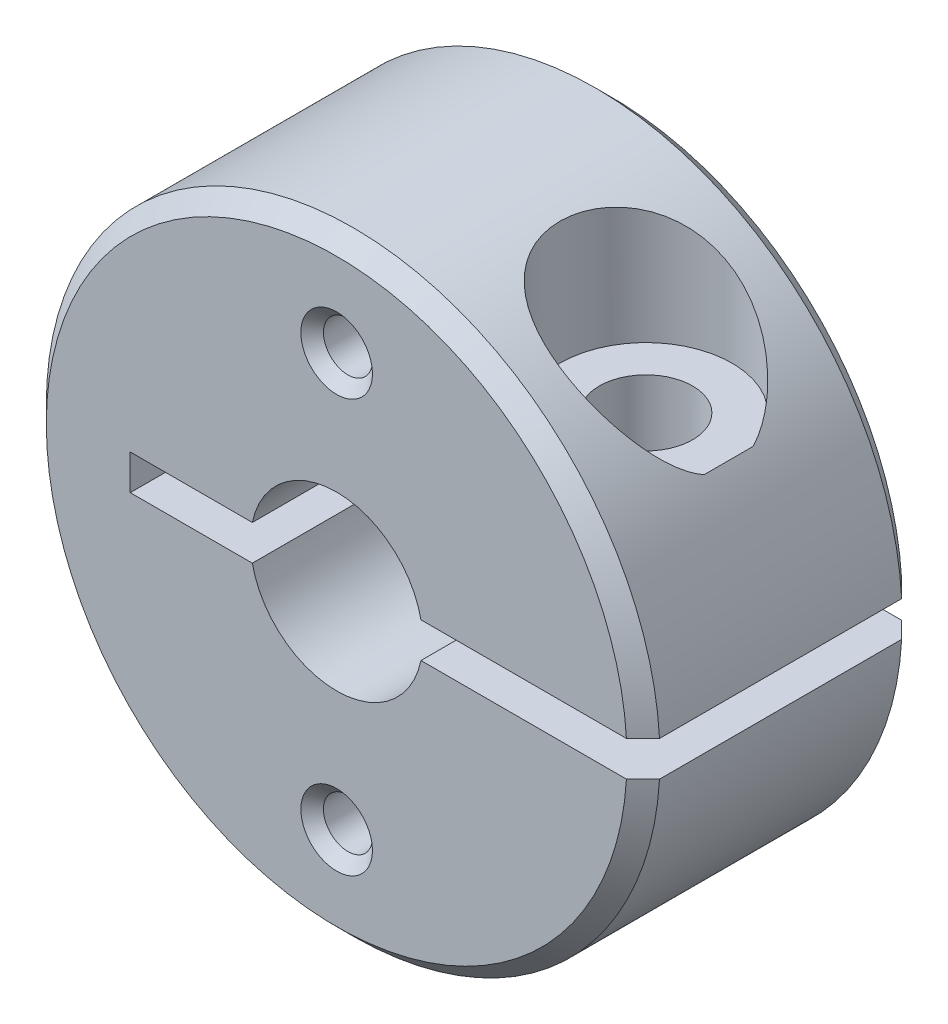
from build123d import *

# Parameters (mm, degrees)
CHAMFER1_SIZE                  = 0.762
F_4_40_TAPPED_HOLE1_AT_2_COUNT = 2
F_4_40_TAPPED_HOLE1_AT_2_PITCH = 19.05
SKETCH4_W                      = 34.925
SKETCH4_H                      = 42.395859198
CUT_EXTRUDE1_DEPTH             = 0.8128


with BuildPart() as part:
    # Sketch1 → Revolve1 (revolve)
    with BuildSketch(Plane(origin=(0, 0, 0), x_dir=(0, 0, -1), z_dir=(1, 0, 0))):
        Polygon((0, 3.9751), (11.684, 3.9751), (11.684, 5.55625), (12.7, 5.55625), (12.7, 14.1605), (0, 14.1605), align=None)
    revolve(axis=Axis((0, 0, -16.392907801), (0, 0, -1)))

    # Chamfer1
    chamfer1_edges = [part.edges().sort_by_distance(p)[0] for p in [
        (0, -14.1605, -12.7),
        (0, -14.1605, 0),
    ]]
    chamfer(chamfer1_edges, length=CHAMFER1_SIZE)

    # Sketch2 → Cut-Revolve1 (revolve, cut)
    with BuildSketch(Plane.XY.offset(-6.35)):
        Polygon((10.07745, 0), (10.07745, 7.9248), (11.8999, 7.9248), (11.8999, 20.6248), (7.9248, 20.6248), (7.9248, -19.869024768), (9.652, -18.871825383), (9.652, -0.245633672), align=None)
    revolve(axis=Axis((7.9248, -19.869024768, -6.35), (0, -1, 0)), mode=Mode.SUBTRACT)

    # Sketch5 → #4-40 Tapped Hole1 (revolve, cut)
    with BuildSketch(Plane(origin=(0, 9.525, -12.7), x_dir=(0, 1, 0), z_dir=(1, 0, 0))):
        Polygon((0, 0), (0, 12.7), (1.651, 12.7), (1.1303, 12.1793), (1.1303, 0.5207), (1.651, 0), align=None)
    f_4_40_tapped_hole1 = revolve(axis=Axis((0, 9.525, -19.05), (0, 0, 1)), mode=Mode.SUBTRACT)

    # #4-40 Tapped Hole1 at 2: #4-40 Tapped Hole1 ×2
    with Locations(*[(0, -i * F_4_40_TAPPED_HOLE1_AT_2_PITCH, 0) for i in range(1, F_4_40_TAPPED_HOLE1_AT_2_COUNT)]):
        add(f_4_40_tapped_hole1, mode=Mode.SUBTRACT)

    # Sketch4 → Cut-Extrude1 (cut, symmetric)
    with BuildSketch(Plane(origin=(0, 0, 0), x_dir=(1, 0, 0), z_dir=(0, 1, 0))):
        with Locations((7.9375, 14.389486552)):
            Rectangle(SKETCH4_W, SKETCH4_H)
    extrude(amount=CUT_EXTRUDE1_DEPTH, both=True, mode=Mode.SUBTRACT)


solid = part.part
